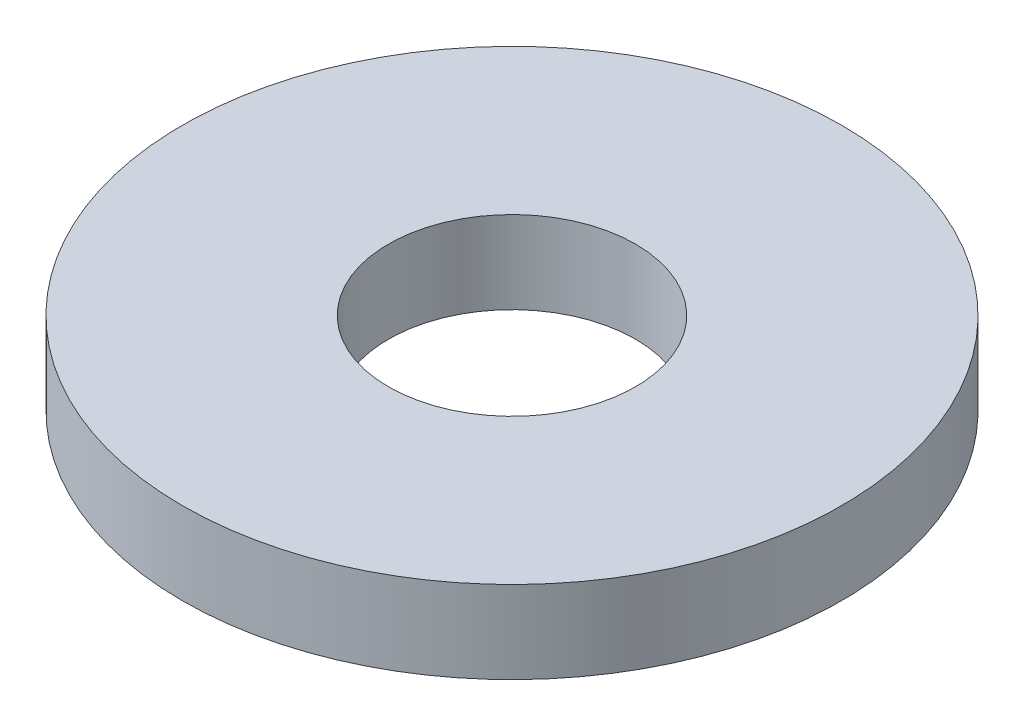
from build123d import *

# Parameters (mm, degrees)
IZIM1_R                     = 4
IZIM1_R_2                   = 1.5
Y_KSEKLIK_EKSTR_ZYON1_DEPTH = 1


with BuildPart() as part:
    # Çizim1 → Yükseklik-Ekstrüzyon1 (new body)
    with BuildSketch(Plane(origin=(0, 0, 0), x_dir=(1, 0, 0), z_dir=(0, 1, 0))):
        with Locations(Location((0, 0, 0), (0, 0, 270))):
            Circle(IZIM1_R)
        with Locations(Location((0, 0, 0), (0, 0, 270))):
            Circle(IZIM1_R_2, mode=Mode.SUBTRACT)
    extrude(amount=Y_KSEKLIK_EKSTR_ZYON1_DEPTH)


solid = part.part
